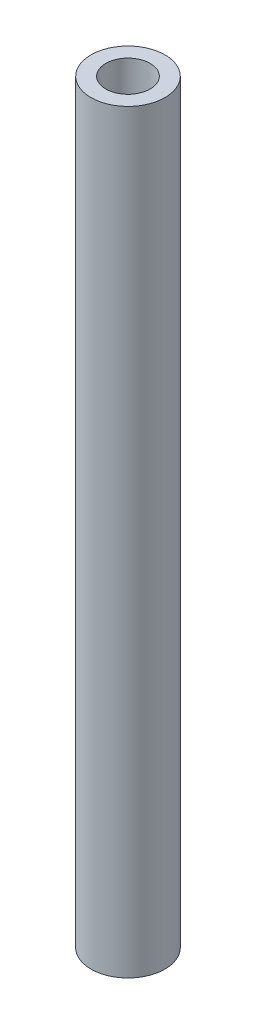
from build123d import *

# Parameters (mm, degrees)
SKETCH1_R           = 2.5
SKETCH1_R_2         = 1.5
BOSS_EXTRUDE1_DEPTH = 51


with BuildPart() as part:
    # Sketch1 → Boss-Extrude1 (new body)
    with BuildSketch(Plane(origin=(0, 0, 0), x_dir=(1, 0, 0), z_dir=(0, 1, 0))):
        with Locations(Location((0, 0, 0), (0, 0, 270))):
            Circle(SKETCH1_R)
        with Locations(Location((0, 0, 0), (0, 0, 270))):
            Circle(SKETCH1_R_2, mode=Mode.SUBTRACT)
    extrude(amount=BOSS_EXTRUDE1_DEPTH)


solid = part.part
